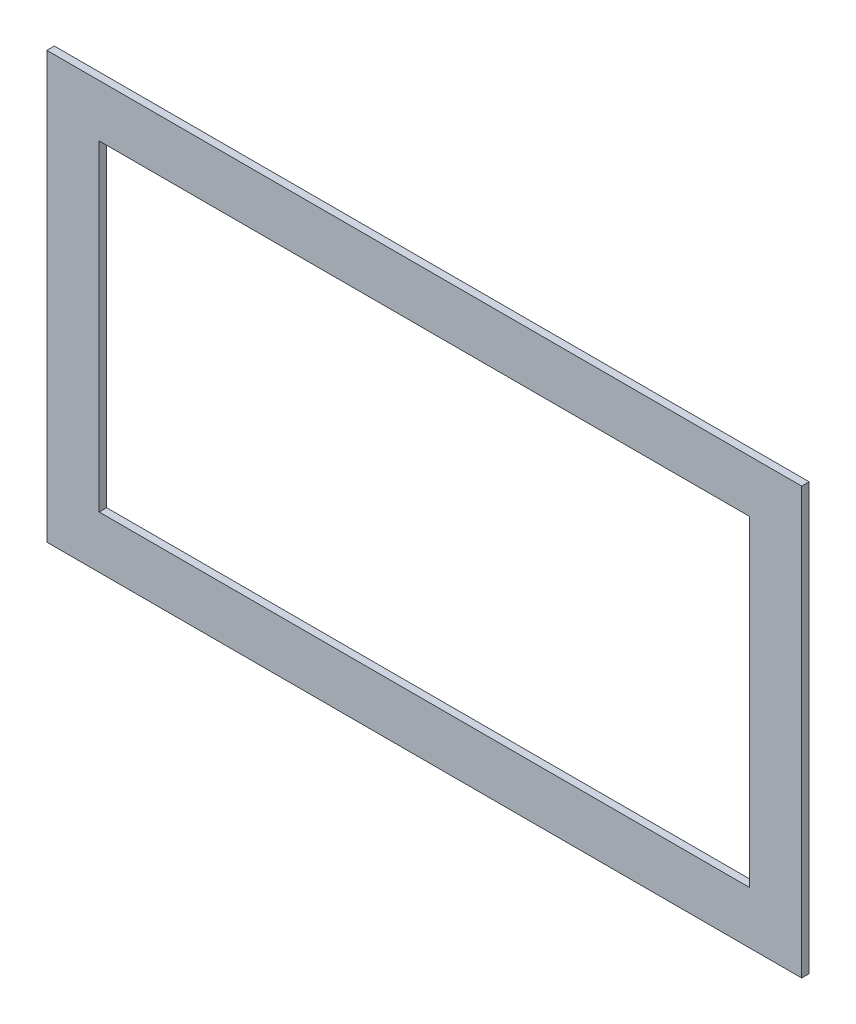
from build123d import *

# Parameters (mm, degrees)
SKETCH1_W     = 101
SKETCH1_H     = 57
SKETCH1_W_2   = 87
SKETCH1_H_2   = 43
PROFILE_DEPTH = 1


with BuildPart() as part:
    # Sketch1 → Profile (new body)
    with BuildSketch(Plane.XY):
        with Locations((50.5, 28.5)):
            Rectangle(SKETCH1_W, SKETCH1_H)
        with Locations((50.5, 28.5)):
            Rectangle(SKETCH1_W_2, SKETCH1_H_2, mode=Mode.SUBTRACT)
    extrude(amount=PROFILE_DEPTH)


solid = part.part
